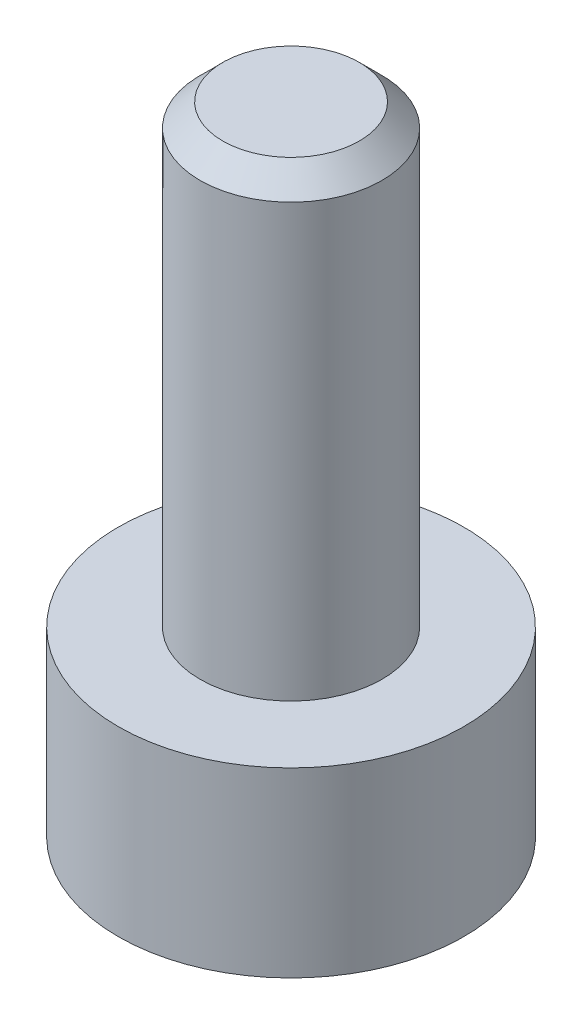
from build123d import *

# Parameters (mm, degrees)
SKETCH1_R           = 1.9
BOSS_EXTRUDE1_DEPTH = 2
SKETCH2_R           = 1
BOSS_EXTRUDE2_DEPTH = 5
CUT_EXTRUDE1_DEPTH  = 1
CHAMFER1_SIZE       = 0.25


with BuildPart() as part:
    # Sketch1 → Boss-Extrude1 (new body)
    with BuildSketch(Plane(origin=(0, 0, 0), x_dir=(1, 0, 0), z_dir=(0, 1, 0))):
        with Locations(Location((0, 0, 0), (0, 0, 270))):
            Circle(SKETCH1_R)
    extrude(amount=BOSS_EXTRUDE1_DEPTH)

    # Sketch2 → Boss-Extrude2 (add)
    with BuildSketch(Plane(origin=(0, 2, 0), x_dir=(1, 0, 0), z_dir=(0, 1, 0))):
        with Locations(Location((0, 0, 0), (0, 0, 270))):
            Circle(SKETCH2_R)
    extrude(amount=BOSS_EXTRUDE2_DEPTH)

    # Sketch3 → Cut-Extrude1 (cut)
    with BuildSketch(Plane.XZ):
        Polygon((0, -0.842636122), (0.75, -0.40962342), (0.75, 0.456401984), (0, 0.889414686), (-0.75, 0.456401984), (-0.75, -0.40962342), align=None)
    extrude(amount=-CUT_EXTRUDE1_DEPTH, mode=Mode.SUBTRACT)

    # Chamfer1
    chamfer1_edges = [part.edges().sort_by_distance(p)[0] for p in [
        (0, 7, -1),
    ]]
    chamfer(chamfer1_edges, length=CHAMFER1_SIZE)


solid = part.part
